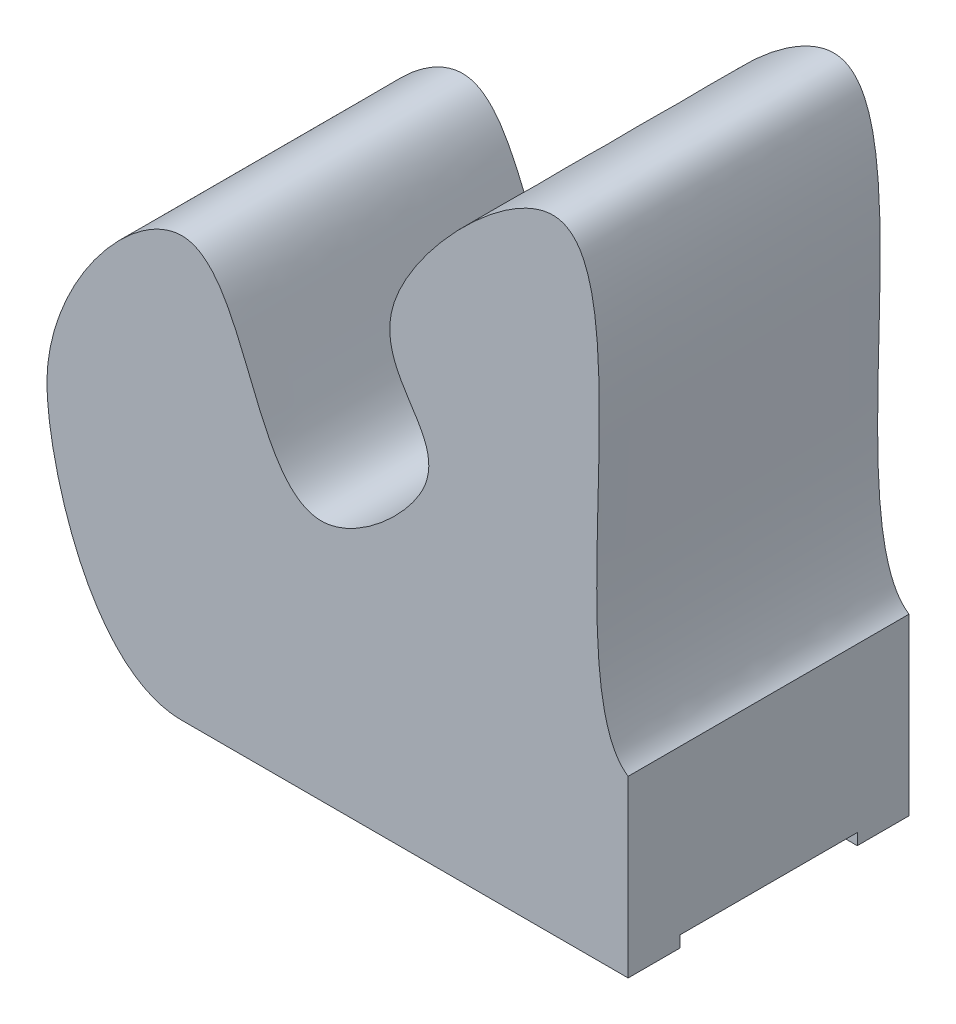
from build123d import *

# Parameters (mm, degrees)
BOSS_EXTRUDE1_DEPTH = 5.9944
SKETCH2_W           = 7.570817784
SKETCH2_H           = 0.973975542
CUT_EXTRUDE1_DEPTH  = 34.258388507
FILLET1_R           = 2.54


with BuildPart() as part:
    # Sketch1 → Boss-Extrude1 (new, symmetric)
    with BuildSketch(Plane.XY):
        with BuildLine():
            Line((0, 0), (19.05, 0))
            Line((19.05, 0), (19.05, 7.455452394))
            add(Edge.make_bspline(
                [(19.05, 7.455452394), (15.865574015, 9.532477989), (21.921917081, 34.986084946), (5.26429967, 17.719699862), (13.316526163, 15.630943423), (3.070236723, 6.429006296), (2.72878714, 23.09716599), (-5.487469222, 13.870223708), (-5.959554293, 7.466879697), (-3.662863867, 0), (0, 0)],
                knots=[0, 0, 0, 0, 0.255088261, 0.380224883, 0.524451039, 0.608261996, 0.787372106, 0.906220789, 0.927483579, 1, 1, 1, 1], degree=3))
        make_face()
    extrude(amount=BOSS_EXTRUDE1_DEPTH, both=True)

    # Sketch2 → Cut-Extrude1 (cut, through all)
    with BuildSketch(Plane(origin=(0, 0, 0), x_dir=(0, 0, -1), z_dir=(1, 0, 0))):
        Rectangle(SKETCH2_W, SKETCH2_H)
    extrude(amount=CUT_EXTRUDE1_DEPTH, mode=Mode.SUBTRACT)

    # Fillet1
    fillet1_edges = [part.edges().sort_by_distance(p)[0] for p in [
        (0, 0.243493885, 3.785408892),
        (0, 0.243493885, -3.785408892),
    ]]
    fillet(fillet1_edges, radius=FILLET1_R)


solid = part.part
